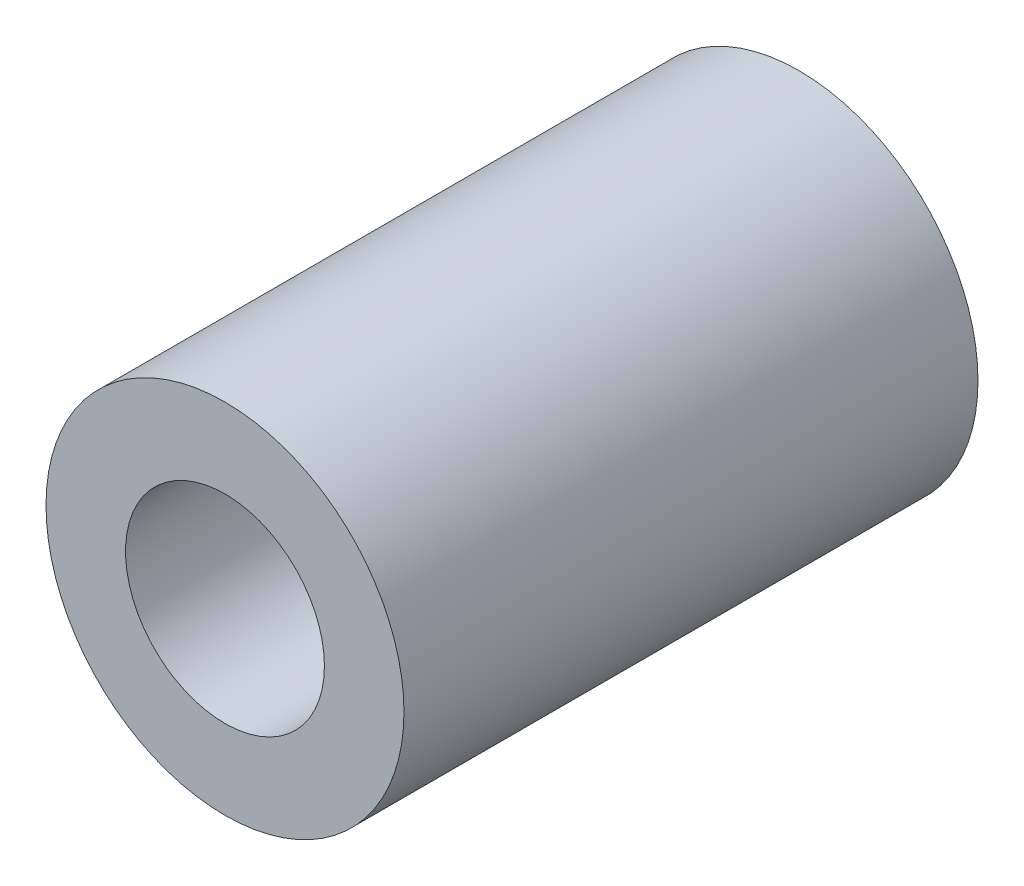
from build123d import *

# Parameters (mm, degrees)
SKETCH1_R           = 7.14375
SKETCH1_R_2         = 3.96875
BOSS_EXTRUDE1_DEPTH = 22.9108


with BuildPart() as part:
    # Sketch1 → Boss-Extrude1 (new body)
    with BuildSketch(Plane.XY):
        Circle(SKETCH1_R)
        Circle(SKETCH1_R_2, mode=Mode.SUBTRACT)
    extrude(amount=-BOSS_EXTRUDE1_DEPTH)


solid = part.part
